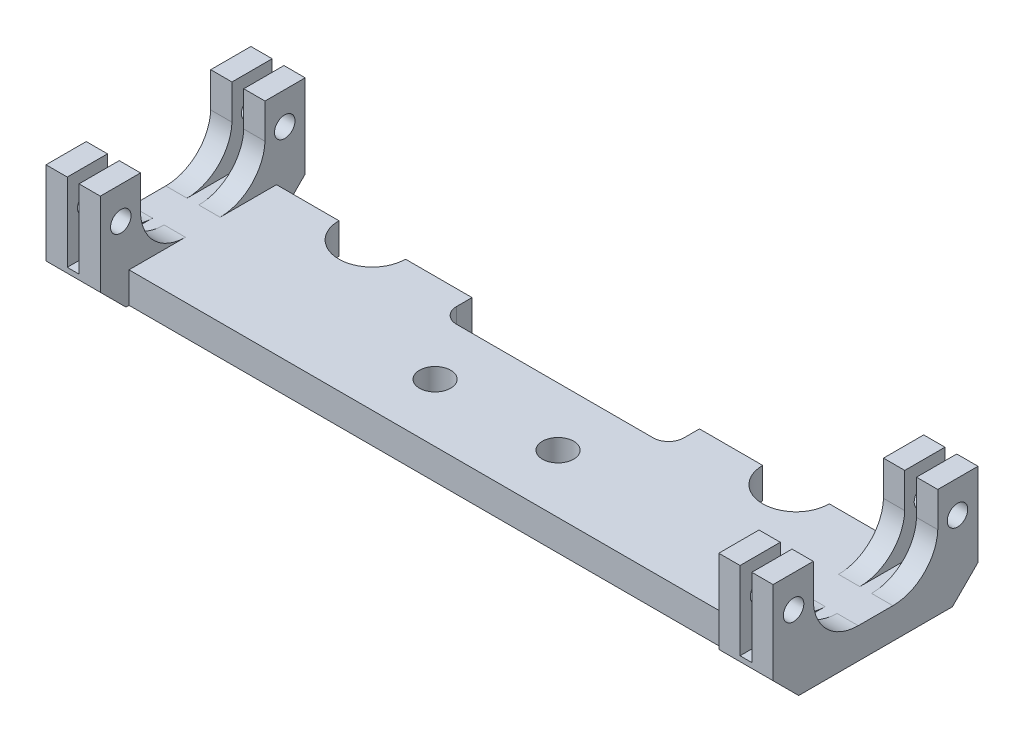
from build123d import *

# Parameters (mm, degrees)
BOSS_EXTRUDE1_DEPTH      = 3
SKETCH2_W                = 14.396583112
SKETCH2_H                = 3
BOSS_EXTRUDE2_DEPTH      = 8.6
SKETCH3_R                = 1
BOSS_EXTRUDE3_DEPTH      = 5.3
SKETCH4_W                = 1.15
SKETCH4_H                = 7.632118098
CUT_EXTRUDE1_DEPTH       = 26.3
CHAMFER1_SIZE            = 2.5
CUT_EXTRUDE2_DEPTH       = 10
CHAMFER1_OF_MIRROR1_SIZE = 2.5
CUT_EXTRUDE5_START       = -10
CUT_EXTRUDE5_DEPTH       = 10
BOSS_EXTRUDE4_DEPTH      = 3
SKETCH7_R                = 1.525
CUT_EXTRUDE6_DEPTH       = 41.163420863


with BuildPart() as part:
    # Sketch1 → Boss-Extrude1 (new body)
    with BuildSketch(Plane(origin=(0, 0, 0), x_dir=(1, 0, 0), z_dir=(0, 1, 0))):
        with BuildLine():
            Line((-26.88337521, 0), (-26.88337521, 14.396583112))
            Line((-26.88337521, 14.396583112), (-24.09337521, 14.396583112))
            ThreePointArc((-24.09337521, 14.396583112), (-20.84337521, 11.146583112), (-17.59337521, 14.396583112))
            Line((-17.59337521, 14.396583112), (0, 14.396583112))
            Line((0, 14.396583112), (0, 0))
            Line((0, 0), (-26.88337521, 0))
        make_face()
    boss_extrude1 = extrude(amount=BOSS_EXTRUDE1_DEPTH)

    # Sketch2 → Boss-Extrude2 (add)
    with BuildSketch(Plane.ZY.offset(26.88337521)):
        with Locations((-7.198291556, 1.5)):
            Rectangle(SKETCH2_W, SKETCH2_H)
    boss_extrude2 = extrude(amount=BOSS_EXTRUDE2_DEPTH)

    # Sketch3 → Boss-Extrude3 (add)
    with BuildSketch(Plane.ZY.offset(35.48337521)):
        with BuildLine():
            Line((1.532781983, 10.632118098), (-1.123291556, 10.632118098))
            Line((-1.123291556, 10.632118098), (-1.123291556, 10.557118098))
            Line((-1.123291556, 10.557118098), (-1.123291556, 7.547815402))
            ThreePointArc((-1.123291556, 7.547815402), (-2.349871735, 4.342215517), (-5.508799885, 3))
            Line((-5.508799885, 3), (-8.887750376, 3))
            ThreePointArc((-8.887750376, 3), (-11.934395079, 4.229921298), (-13.273291556, 7.230272374))
            Line((-13.273291556, 7.230272374), (-13.273291556, 10.557118098))
            Line((-13.273291556, 10.557118098), (-13.273291556, 10.632118098))
            Line((-13.273291556, 10.632118098), (-15.929365096, 10.632118098))
            Line((-15.929365096, 10.632118098), (-17.198291556, 10.632118098))
            Line((-17.198291556, 10.632118098), (-17.198291556, 7.5))
            Line((-17.198291556, 7.5), (-17.198291556, 0))
            Line((-17.198291556, 0), (-14.396583112, 0))
            Line((-14.396583112, 0), (0, 0))
            Line((0, 0), (2.801708444, 0))
            Line((2.801708444, 0), (2.801708444, 7.5))
            Line((2.801708444, 7.5), (2.801708444, 10.632118098))
            Line((2.801708444, 10.632118098), (1.532781983, 10.632118098))
        make_face()
        with Locations((-15.198291556, 7.5)):
            Circle(SKETCH3_R, mode=Mode.SUBTRACT)
        with Locations((0.801708444, 7.5)):
            Circle(SKETCH3_R, mode=Mode.SUBTRACT)
    boss_extrude3 = extrude(amount=-BOSS_EXTRUDE3_DEPTH)

    # Sketch4 → Cut-Extrude1 (cut)
    with BuildSketch(Plane.XY.offset(2.801708444)):
        with Locations((-32.83337521, 6.816059049)):
            Rectangle(SKETCH4_W, SKETCH4_H)
    cut_extrude1 = extrude(amount=-CUT_EXTRUDE1_DEPTH, mode=Mode.SUBTRACT)

    # Chamfer1
    chamfer1_edges = [part.edges().sort_by_distance(p)[0] for p in [
        (-32.83337521, 0, -17.198291556),
        (-32.83337521, 0, 2.801708444),
    ]]
    chamfer(chamfer1_edges, length=CHAMFER1_SIZE)

    # Sketch5 → Cut-Extrude2 (cut)
    with BuildSketch(Plane(origin=(0, 3, 0), x_dir=(1, 0, 0), z_dir=(0, 1, 0))):
        with BuildLine():
            Line((0, 11.381166784), (-9.598972409, 11.381166784))
            ThreePointArc((-9.598972409, 11.381166784), (-10.65963258, 11.820506612), (-11.098972409, 12.881166784))
            Line((-11.098972409, 12.881166784), (-11.098972409, 14.396583112))
            Line((-11.098972409, 14.396583112), (0, 14.396583112))
            Line((0, 14.396583112), (0, 11.381166784))
        make_face()
    cut_extrude2 = extrude(amount=-CUT_EXTRUDE2_DEPTH, mode=Mode.SUBTRACT)

    # Mirror1: Boss-Extrude1, Boss-Extrude2, Boss-Extrude3, Cut-Extrude1, Cut-Extrude2 across plane
    add(boss_extrude1.mirror(Plane(origin=(0, 0, 0), x_dir=(0, 0, 1), z_dir=(1, 0, 0))))
    add(boss_extrude2.mirror(Plane(origin=(0, 0, 0), x_dir=(0, 0, 1), z_dir=(1, 0, 0))))
    add(boss_extrude3.mirror(Plane(origin=(0, 0, 0), x_dir=(0, 0, 1), z_dir=(1, 0, 0))))
    add(cut_extrude1.mirror(Plane(origin=(0, 0, 0), x_dir=(0, 0, 1), z_dir=(1, 0, 0))), mode=Mode.SUBTRACT)
    add(cut_extrude2.mirror(Plane(origin=(0, 0, 0), x_dir=(0, 0, 1), z_dir=(1, 0, 0))), mode=Mode.SUBTRACT)

    # Chamfer1 of Mirror1
    chamfer1_of_mirror1_edges = [part.edges().sort_by_distance(p)[0] for p in [
        (32.83337521, 0, -17.198291556),
        (32.83337521, 0, 2.801708444),
    ]]
    chamfer(chamfer1_of_mirror1_edges, length=CHAMFER1_OF_MIRROR1_SIZE)

    # Sketch6 → Cut-Extrude5 (cut)
    with BuildSketch(Plane(origin=(0, 3, 0), x_dir=(1, 0, 0), z_dir=(0, 1, 0)).offset(CUT_EXTRUDE5_START)):
        with BuildLine():
            ThreePointArc((20.68337521, 11.150523963), (22.877361191, 12.155768528), (23.77337521, 14.396583112))
            ThreePointArc((23.77337521, 14.396583112), (20.52337521, 17.646583112), (17.27337521, 14.396583112))
            Line((17.27337521, 14.396583112), (17.59337521, 14.396583112))
            ThreePointArc((17.59337521, 14.396583112), (18.489389228, 12.155768528), (20.68337521, 11.150523963))
        make_face()
        with BuildLine():
            Line((17.59337521, 14.396583112), (17.27337521, 14.396583112))
            ThreePointArc((17.27337521, 14.396583112), (18.282560626, 12.042597131), (20.68337521, 11.150523963))
            ThreePointArc((20.68337521, 11.150523963), (18.489389228, 12.155768528), (17.59337521, 14.396583112))
        make_face()
    extrude(amount=CUT_EXTRUDE5_DEPTH, mode=Mode.SUBTRACT)

    # Sketch6<3> → Boss-Extrude4 (add, through all)
    with BuildSketch(Plane(origin=(0, 3, 0), x_dir=(1, 0, 0), z_dir=(0, 1, 0))):
        with BuildLine():
            Line((24.09337521, 14.396583112), (23.77337521, 14.396583112))
            ThreePointArc((23.77337521, 14.396583112), (22.877361191, 12.155768528), (20.68337521, 11.150523963))
            ThreePointArc((20.68337521, 11.150523963), (20.763350947, 11.147568474), (20.84337521, 11.146583112))
            ThreePointArc((20.84337521, 11.146583112), (23.141472249, 12.098486073), (24.09337521, 14.396583112))
        make_face()
    extrude(amount=-BOSS_EXTRUDE4_DEPTH)

    # Sketch7 → Cut-Extrude6 (cut, through all)
    with BuildSketch(Plane(origin=(0, 3, 0), x_dir=(1, 0, 0), z_dir=(0, 1, 0))):
        with Locations(Location((-6, 5.690583392, 0), (0, 0, 270))):
            Circle(SKETCH7_R)
        with Locations(Location((6, 5.690583392, 0), (0, 0, 90))):
            Circle(SKETCH7_R)
    extrude(amount=-CUT_EXTRUDE6_DEPTH, mode=Mode.SUBTRACT)


solid = part.part
